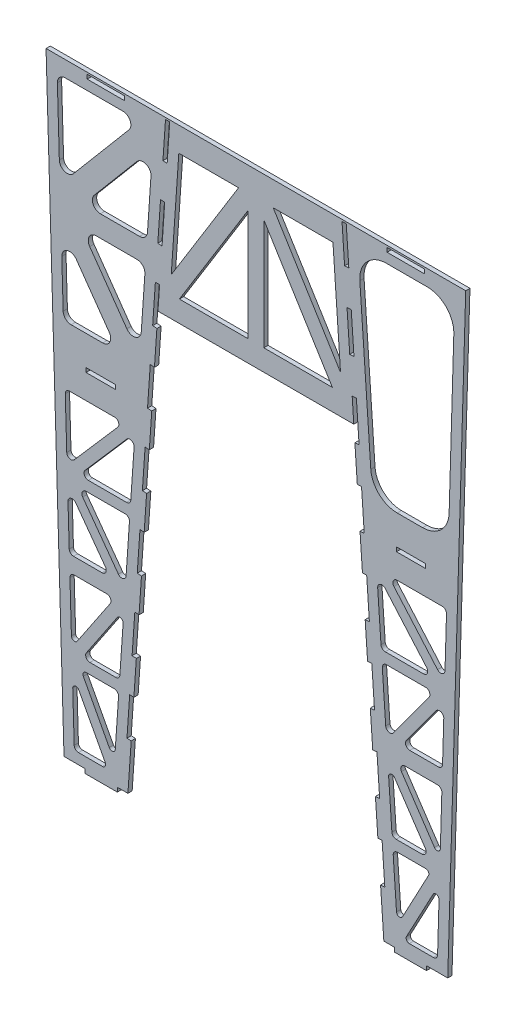
from build123d import *

# Parameters (mm, degrees)
BOSS_EXTRUDE1_DEPTH     = 10.16
CUT_EXTRUDE5_DEPTH      = 12.7
SKETCH4_W               = 90
SKETCH4_H               = 10.16
SKETCH4_W_2             = 70
CUT_EXTRUDE6_DEPTH      = 1550.063532362
CUT_EXTRUDE7_DEPTH      = 1550.063532362
FILLET3_R               = 10.16
FILLET4_R               = 7.62
FILLET5_R               = 19.05
FILLET3_OF_MIRROR2_R    = 10.16
FILLET4_OF_MIRROR2_R    = 7.62
FILLET5_OF_MIRROR2_R    = 19.05
CUT_EXTRUDE8_DEPTH      = 1550.063532362
CUT_EXTRUDE8_DEPTH_BACK = 1550.063532362
FILLET6_R               = 63.5


with BuildPart() as part:
    # Sketch1 → Boss-Extrude1 (new body)
    with BuildSketch(Plane.XY):
        Polygon((-502.783260205, 1465.163333881), (-459.721789204, 17.476365817), (-408.921789204, 17.476365817), (-408.921789204, 7.316365817), (-332.100796745, 7.316365817), (-332.100796745, 17.476365817), (-306.627827519, 17.476365817), (-234.627172097, 1054.1), (234.627172097, 1054.1), (306.627827519, 17.476365817), (332.721789205, 17.476365817), (332.721789205, 7.316365817), (408.921789205, 7.316365817), (408.921789205, 17.476365817), (459.721789204, 17.476365817), (502.783260205, 1465.163333881), align=None)
        Polygon((183.241684323, 1104.9), (19.05, 1104.9), (19.05, 1370.513438368), align=None, mode=Mode.SUBTRACT)
        Polygon((-184.672467887, 1406.743333881), (-41.445883295, 1406.743333881), (-202.80261453, 1145.716008632), align=None, mode=Mode.SUBTRACT)
        Polygon((-19.05, 1370.513438368), (-19.05, 1104.9), (-183.241684323, 1104.9), align=None, mode=Mode.SUBTRACT)
        Polygon((184.672467887, 1406.743333881), (202.80261453, 1145.716008632), (41.445883295, 1406.743333881), align=None, mode=Mode.SUBTRACT)
    extrude(amount=BOSS_EXTRUDE1_DEPTH)

    # Sketch2 → Cut-Extrude5 (cut)
    with BuildSketch(Plane.XY):
        Polygon((-222.69422447, 1372.274878096), (-212.576544386, 1371.572135487), (-206.36877838, 1460.947946306), (-216.535268781, 1460.947946306), align=None)
        Polygon((-224.894455765, 1194.225999066), (-235.012135849, 1194.928741675), (-228.490407278, 1288.824803216), (-218.372727194, 1288.122060607), align=None)
        Polygon((224.894455765, 1194.225999066), (235.012135849, 1194.928741675), (228.490407278, 1288.824803216), (218.372727194, 1288.122060607), align=None)
        Polygon((212.576544386, 1371.572135487), (222.694224471, 1372.274878096), (216.535268781, 1460.947946306), (206.36877838, 1460.947946306), align=None)
        Polygon((-240.810161517, 1111.452134365), (-247.330047228, 1017.582605255), (-237.212367144, 1016.879862645), (-230.692481433, 1110.749391756), align=None)
        Polygon((237.212367144, 1016.879862645), (247.330047228, 1017.582605255), (240.810161517, 1111.452134365), (230.692481433, 1110.749391756), align=None)
        Polygon((-298.801924037, 130.149180543), (-292.291252627, 223.886047498), (-302.408932711, 224.588790108), (-308.919604121, 130.851923152), align=None)
        Polygon((-243.012235672, 933.376722904), (-253.129915756, 934.079465513), (-259.647958606, 840.236468834), (-249.530278522, 839.533726225), align=None)
        Polygon((243.012235672, 933.376722904), (253.129915756, 934.079465513), (259.647958606, 840.236468834), (249.530278522, 839.533726225), align=None)
        Polygon((-274.16610128, 484.841453384), (-284.283781364, 485.544195993), (-277.769424233, 579.334127811), (-267.651744149, 578.631385201), align=None)
        Polygon((-261.848189901, 662.187589804), (-271.965869985, 662.890332413), (-265.449669994, 756.706796662), (-255.33198991, 756.004054053), align=None)
        Polygon((261.848189901, 662.187589804), (271.965869985, 662.890332413), (265.449669994, 756.706796662), (255.33198991, 756.004054053), align=None)
        Polygon((274.16610128, 484.841453384), (284.283781364, 485.544195993), (277.769424233, 579.334127811), (267.651744149, 578.631385201), align=None)
        Polygon((-286.484012658, 307.495316963), (-296.601692742, 308.198059572), (-290.089178472, 401.961458959), (-279.971498388, 401.25871635), align=None)
        Polygon((286.484012658, 307.495316963), (296.601692742, 308.198059572), (290.089178472, 401.961458959), (279.971498388, 401.25871635), align=None)
        Polygon((298.801924037, 130.149180543), (308.919604121, 130.851923152), (302.408932711, 224.588790108), (292.291252627, 223.886047498), align=None)
    extrude(amount=CUT_EXTRUDE5_DEPTH, mode=Mode.SUBTRACT)

    # Sketch4 → Cut-Extrude6 (cut, symmetric)
    with BuildSketch(Plane.XY.offset(10.16)):
        with Locations((359.414757075, 1455.867946306)):
            Rectangle(SKETCH4_W, SKETCH4_H)
        with Locations((371.959754256, 845.707946306)):
            Rectangle(SKETCH4_W_2, SKETCH4_H)
    cut_extrude6 = extrude(amount=CUT_EXTRUDE6_DEPTH, both=True, mode=Mode.SUBTRACT)

    # Mirror1: Cut-Extrude6 across plane
    add(cut_extrude6.mirror(Plane(origin=(0, 0, 0), x_dir=(0, 0, 1), z_dir=(1, 0, 0))), mode=Mode.SUBTRACT)

    # Sketch5 → Cut-Extrude7 (cut, symmetric)
    with BuildSketch(Plane.XY.offset(10.16)):
        Polygon((277.593877008, 1427.063333881), (469.47927215, 1199.81621822), (476.23874108, 1427.063333881), align=None)
        Polygon((247.329614232, 1384.164333592), (261.011142, 1187.185640094), (413.656629325, 1187.185640094), align=None)
        Polygon((264.539552095, 1136.385640094), (278.41461261, 936.620574466), (419.344293927, 1136.385640094), align=None)
        Polygon((330.204469173, 921.907946306), (461.212886352, 921.907946306), (466.979738924, 1115.784214832), align=None)
        Polygon((316.142218511, 782.207946306), (452.399446564, 625.608223406), (457.057507716, 782.207946306), align=None)
        Polygon((289.717943699, 773.881776008), (300.433872741, 619.600051184), (423.958284452, 619.600051184), align=None)
        Polygon((302.198077788, 594.200051184), (313.009575905, 438.542378305), (426.824131149, 594.200051184), align=None)
        Polygon((348.679309283, 444.292156061), (447.006197368, 444.292156061), (451.175812533, 584.470775043), align=None)
        Polygon((338.203960851, 406.192156061), (441.307140894, 252.695129833), (445.872912286, 406.192156061), align=None)
        Polygon((316.138874391, 393.488555534), (326.550760736, 243.584260939), (416.828834676, 243.584260939), align=None)
        Polygon((328.314965783, 218.184260939), (338.831686046, 66.770628464), (419.502020465, 218.184260939), align=None)
        Polygon((354.881342017, 42.876365817), (435.06607855, 42.876365817), (439.807479589, 202.277898914), align=None)
    cut_extrude7 = extrude(amount=CUT_EXTRUDE7_DEPTH, both=True, mode=Mode.SUBTRACT)

    # Fillet3
    fillet3_edges = [part.edges().sort_by_distance(p)[0] for p in [
        (423.958284452, 619.600051184, 5.08),
        (300.433872741, 619.600051184, 5.08),
        (289.717943699, 773.881776008, 5.08),
        (426.824131149, 594.200051184, 5.08),
        (313.009575905, 438.542378305, 5.08),
        (302.198077788, 594.200051184, 5.08),
        (348.679309283, 444.292156061, 5.08),
        (451.175812533, 584.470775043, 5.08),
        (447.006197368, 444.292156061, 5.08),
        (338.203960851, 406.192156061, 5.08),
        (445.872912286, 406.192156061, 5.08),
        (316.142218511, 782.207946306, 5.08),
        (457.057507716, 782.207946306, 5.08),
        (452.399446564, 625.608223406, 5.08),
        (435.06607855, 42.876365817, 5.08),
        (328.314965783, 218.184260939, 5.08),
        (416.828834676, 243.584260939, 5.08),
        (326.550760736, 243.584260939, 5.08),
    ]]
    fillet(fillet3_edges, radius=FILLET3_R)

    # Fillet4
    fillet4_edges = [part.edges().sort_by_distance(p)[0] for p in [
        (441.307140894, 252.695129833, 5.08),
        (354.881342017, 42.876365817, 5.08),
        (439.807479589, 202.277898914, 5.08),
        (419.502020465, 218.184260939, 5.08),
        (338.831686046, 66.770628464, 5.08),
        (316.138874391, 393.488555534, 5.08),
    ]]
    fillet(fillet4_edges, radius=FILLET4_R)

    # Fillet5
    fillet5_edges = [part.edges().sort_by_distance(p)[0] for p in [
        (413.656629325, 1187.185640094, 5.08),
        (261.011142, 1187.185640094, 5.08),
        (247.329614232, 1384.164333592, 5.08),
        (419.344293927, 1136.385640094, 5.08),
        (278.41461261, 936.620574466, 5.08),
        (264.539552095, 1136.385640094, 5.08),
        (330.204469173, 921.907946306, 5.08),
        (466.979738924, 1115.784214832, 5.08),
        (461.212886352, 921.907946306, 5.08),
        (277.593877008, 1427.063333881, 5.08),
        (476.23874108, 1427.063333881, 5.08),
        (469.47927215, 1199.81621822, 5.08),
    ]]
    fillet(fillet5_edges, radius=FILLET5_R)

    # Mirror2: Cut-Extrude7 across plane
    add(cut_extrude7.mirror(Plane(origin=(0, 0, 0), x_dir=(0, 0, 1), z_dir=(1, 0, 0))), mode=Mode.SUBTRACT)

    # Fillet3 of Mirror2
    fillet3_of_mirror2_edges = [part.edges().sort_by_distance(p)[0] for p in [
        (-423.958284452, 619.600051184, 5.08),
        (-300.433872741, 619.600051184, 5.08),
        (-289.717943699, 773.881776008, 5.08),
        (-426.824131149, 594.200051184, 5.08),
        (-313.009575905, 438.542378305, 5.08),
        (-302.198077788, 594.200051184, 5.08),
        (-348.679309283, 444.292156061, 5.08),
        (-451.175812533, 584.470775043, 5.08),
        (-447.006197368, 444.292156061, 5.08),
        (-338.203960851, 406.192156061, 5.08),
        (-445.872912286, 406.192156061, 5.08),
        (-316.142218511, 782.207946306, 5.08),
        (-457.057507716, 782.207946306, 5.08),
        (-452.399446564, 625.608223406, 5.08),
        (-435.06607855, 42.876365817, 5.08),
        (-328.314965783, 218.184260939, 5.08),
        (-416.828834676, 243.584260939, 5.08),
        (-326.550760736, 243.584260939, 5.08),
    ]]
    fillet(fillet3_of_mirror2_edges, radius=FILLET3_OF_MIRROR2_R)

    # Fillet4 of Mirror2
    fillet4_of_mirror2_edges = [part.edges().sort_by_distance(p)[0] for p in [
        (-441.307140894, 252.695129833, 5.08),
        (-354.881342017, 42.876365817, 5.08),
        (-439.807479589, 202.277898914, 5.08),
        (-419.502020465, 218.184260939, 5.08),
        (-338.831686046, 66.770628464, 5.08),
        (-316.138874391, 393.488555534, 5.08),
    ]]
    fillet(fillet4_of_mirror2_edges, radius=FILLET4_OF_MIRROR2_R)

    # Fillet5 of Mirror2
    fillet5_of_mirror2_edges = [part.edges().sort_by_distance(p)[0] for p in [
        (-413.656629325, 1187.185640094, 5.08),
        (-261.011142, 1187.185640094, 5.08),
        (-247.329614232, 1384.164333592, 5.08),
        (-419.344293927, 1136.385640094, 5.08),
        (-278.41461261, 936.620574466, 5.08),
        (-264.539552095, 1136.385640094, 5.08),
        (-330.204469173, 921.907946306, 5.08),
        (-466.979738924, 1115.784214832, 5.08),
        (-461.212886352, 921.907946306, 5.08),
        (-277.593877008, 1427.063333881, 5.08),
        (-476.23874108, 1427.063333881, 5.08),
        (-469.47927215, 1199.81621822, 5.08),
    ]]
    fillet(fillet5_of_mirror2_edges, radius=FILLET5_OF_MIRROR2_R)

    # Sketch6 → Cut-Extrude8 (cut, two sides: drawn at the far end of the back side and taken through both)
    with BuildSketch(Plane.XY.offset(10.16).offset(-CUT_EXTRUDE8_DEPTH_BACK)):
        Polygon((244.349983018, 1427.063333881), (279.43650603, 921.907946306), (461.212886352, 921.907946306), (476.23874108, 1427.063333881), align=None)
    extrude(amount=CUT_EXTRUDE8_DEPTH + CUT_EXTRUDE8_DEPTH_BACK, mode=Mode.SUBTRACT)

    # Fillet6
    fillet6_edges = [part.edges().sort_by_distance(p)[0] for p in [
        (279.43650603, 921.907946306, 5.08),
        (244.349983018, 1427.063333881, 5.08),
        (476.23874108, 1427.063333881, 5.08),
        (461.212886352, 921.907946306, 5.08),
    ]]
    fillet(fillet6_edges, radius=FILLET6_R)


solid = part.part
